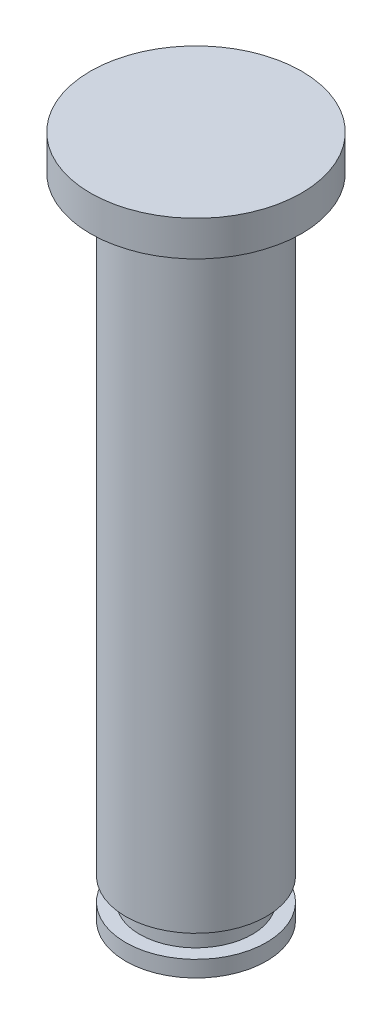
from build123d import *

# Parameters (mm, degrees)
SKETCH1_R           = 1
BOSS_EXTRUDE1_DEPTH = 9.2
SKETCH2_R           = 1.5
BOSS_EXTRUDE2_DEPTH = 0.5
SKETCH4_W           = 0.2
SKETCH4_H           = 0.32


with BuildPart() as part:
    # Sketch1 → Boss-Extrude1 (new body)
    with BuildSketch(Plane(origin=(0, 0, 0), x_dir=(1, 0, 0), z_dir=(0, 1, 0))):
        with Locations(Location((0, 0, 0), (0, 0, 270))):
            Circle(SKETCH1_R)
    extrude(amount=BOSS_EXTRUDE1_DEPTH)

    # Sketch2 → Boss-Extrude2 (add)
    with BuildSketch(Plane(origin=(0, 9.2, 0), x_dir=(1, 0, 0), z_dir=(0, 1, 0))):
        with Locations(Location((0, 0, 0), (0, 0, 270))):
            Circle(SKETCH2_R)
    extrude(amount=BOSS_EXTRUDE2_DEPTH)

    # Sketch4 → Cut-Revolve4 (revolve, cut)
    with BuildSketch(Plane(origin=(0, 0, 0), x_dir=(0, 0, -1), z_dir=(1, 0, 0))):
        with Locations((-0.9, 0.39)):
            Rectangle(SKETCH4_W, SKETCH4_H)
    revolve(axis=Axis((0, 9.2, 0), (0, -1, 0)), mode=Mode.SUBTRACT)


solid = part.part
